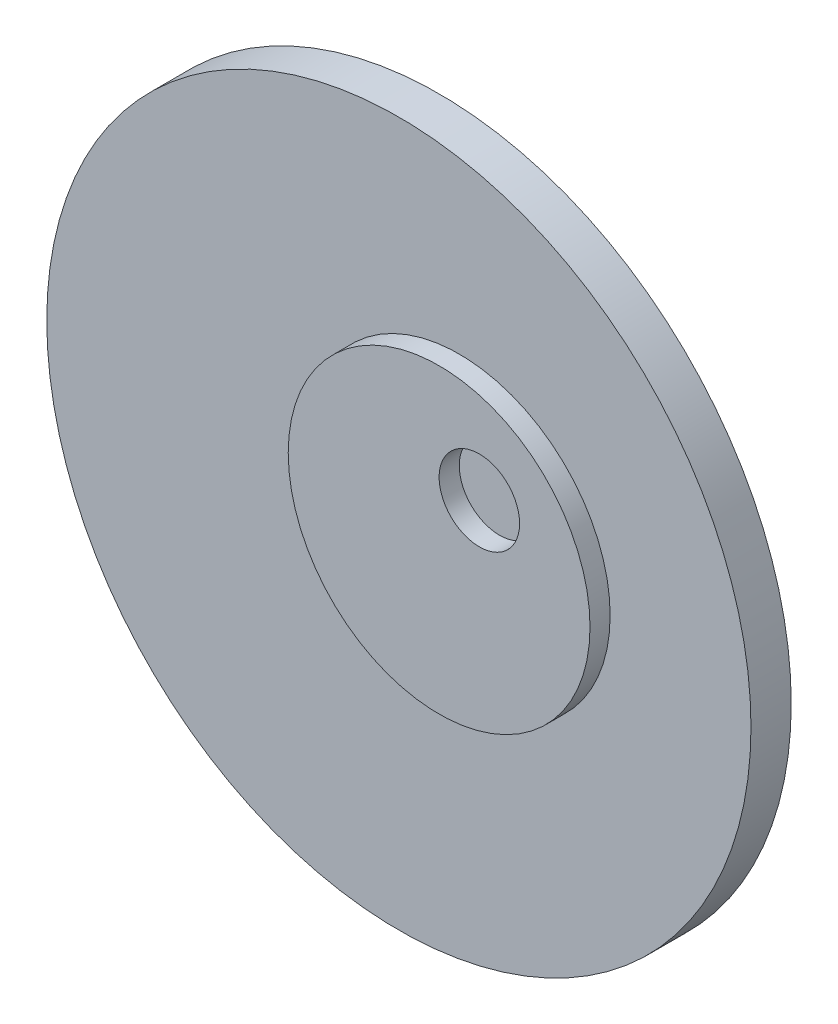
from build123d import *

# Parameters (mm, degrees)
SKETCH1_R           = 17.5
BOSS_EXTRUDE1_DEPTH = 2
SKETCH2_R           = 7.5
SKETCH2_R_2         = 2
BOSS_EXTRUDE2_DEPTH = 1


with BuildPart() as part:
    # Sketch1 → Boss-Extrude1 (new body)
    with BuildSketch(Plane.XY):
        Circle(SKETCH1_R)
    extrude(amount=BOSS_EXTRUDE1_DEPTH)


with BuildPart() as body_2:
    # Sketch2 → Boss-Extrude2 (new body)
    with BuildSketch(Plane.XY.offset(2)):
        with Locations((3, 1.3)):
            Circle(SKETCH2_R)
        with Locations((5, 4)):
            Circle(SKETCH2_R_2, mode=Mode.SUBTRACT)
    extrude(amount=BOSS_EXTRUDE2_DEPTH)


solid = Compound([part.part, body_2.part])
